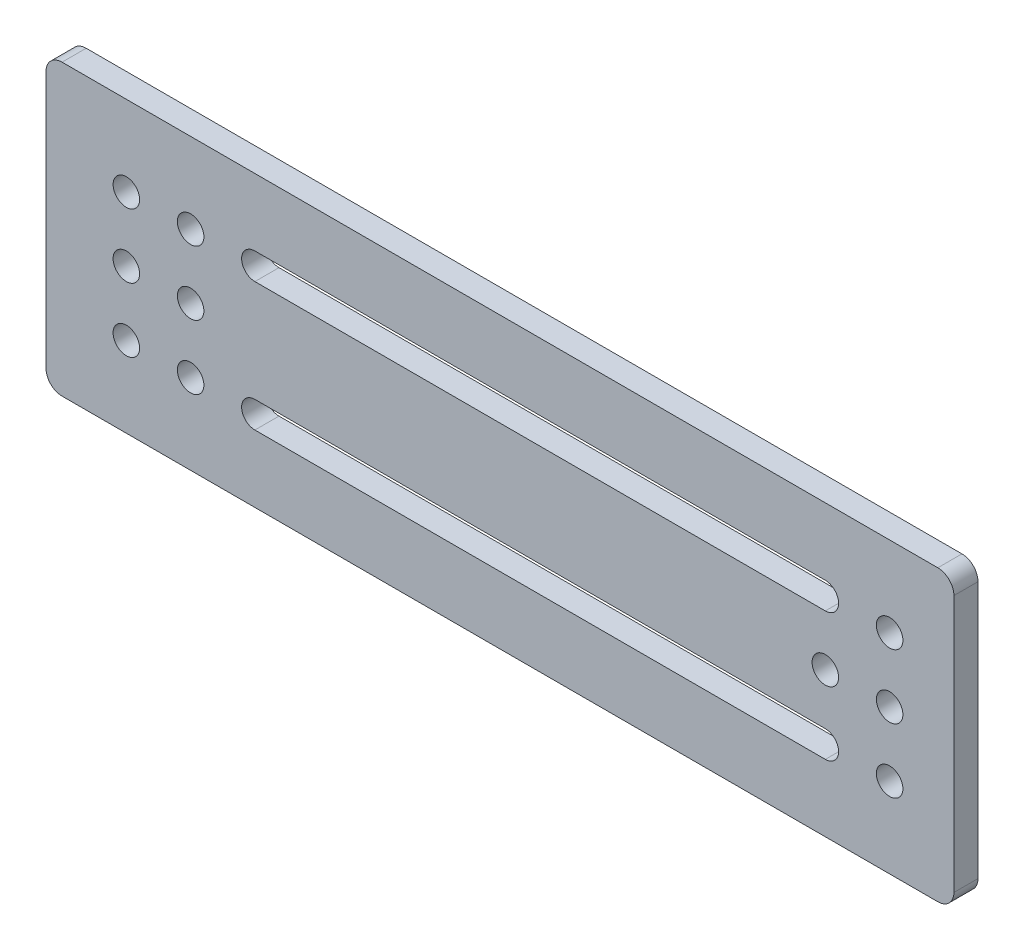
from build123d import *

# Parameters (mm, degrees)
SKETCH_1_W      = 113
SKETCH_1_H      = 36
SKETCH_1_R      = 1.65
EXTRUDE_1_DEPTH = 3
FILLET_1_R      = 2


with BuildPart() as part:
    # 草图1 → 凸台-拉伸1 (new body)
    with BuildSketch(Plane.XY):
        with Locations((56.5, 18)):
            Rectangle(SKETCH_1_W, SKETCH_1_H)
        with Locations((10, 10)):
            Circle(SKETCH_1_R, mode=Mode.SUBTRACT)
        with Locations((18, 10)):
            Circle(SKETCH_1_R, mode=Mode.SUBTRACT)
        with BuildLine():
            ThreePointArc((26, 8.35), (24.35, 10), (26, 11.65))
            Line((26, 11.65), (97, 11.65))
            ThreePointArc((97, 11.65), (98.166726189, 11.166726189), (98.65, 10))
            ThreePointArc((98.65, 10), (98.166726189, 8.833273811), (97, 8.35))
            Line((97, 8.35), (26, 8.35))
        make_face(mode=Mode.SUBTRACT)
        with Locations((105, 10)):
            Circle(SKETCH_1_R, mode=Mode.SUBTRACT)
        with Locations((10, 18)):
            Circle(SKETCH_1_R, mode=Mode.SUBTRACT)
        with Locations((18, 18)):
            Circle(SKETCH_1_R, mode=Mode.SUBTRACT)
        with Locations((10, 26)):
            Circle(SKETCH_1_R, mode=Mode.SUBTRACT)
        with Locations((18, 26)):
            Circle(SKETCH_1_R, mode=Mode.SUBTRACT)
        with BuildLine():
            ThreePointArc((26, 24.35), (24.35, 26), (26, 27.65))
            Line((26, 27.65), (97, 27.65))
            ThreePointArc((97, 27.65), (98.166726189, 27.166726189), (98.65, 26))
            ThreePointArc((98.65, 26), (98.166726189, 24.833273811), (97, 24.35))
            Line((97, 24.35), (26, 24.35))
        make_face(mode=Mode.SUBTRACT)
        with Locations((97, 18)):
            Circle(SKETCH_1_R, mode=Mode.SUBTRACT)
        with Locations((105, 18)):
            Circle(SKETCH_1_R, mode=Mode.SUBTRACT)
        with Locations((105, 26)):
            Circle(SKETCH_1_R, mode=Mode.SUBTRACT)
    extrude(amount=EXTRUDE_1_DEPTH)

    # 圆角1
    fillet_1_edges = [part.edges().sort_by_distance(p)[0] for p in [
        (0, 0, 1.5),
        (0, 36, 1.5),
        (113, 36, 1.5),
        (113, 0, 1.5),
    ]]
    fillet(fillet_1_edges, radius=FILLET_1_R)


solid = part.part
